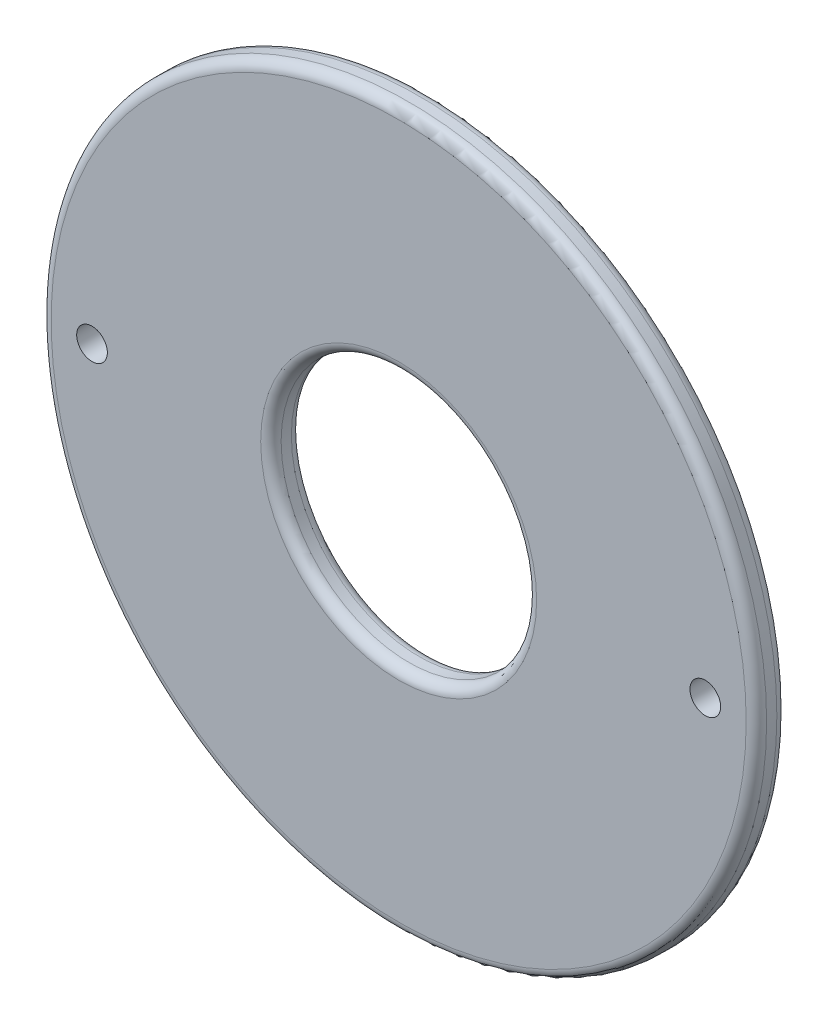
from build123d import *

# Parameters (mm, degrees)
CROQUIS1_R              = 35
CROQUIS1_R_2            = 12.5
CROQUIS1_R_3            = 1.5
SALIENTE_EXTRUIR1_DEPTH = 3
REDONDEO1_R             = 1


with BuildPart() as part:
    # Croquis1 → Saliente-Extruir1 (new body)
    with BuildSketch(Plane.XY):
        Circle(CROQUIS1_R)
        Circle(CROQUIS1_R_2, mode=Mode.SUBTRACT)
        with Locations((30, 0)):
            Circle(CROQUIS1_R_3, mode=Mode.SUBTRACT)
        with Locations((-30, 0)):
            Circle(CROQUIS1_R_3, mode=Mode.SUBTRACT)
    extrude(amount=SALIENTE_EXTRUIR1_DEPTH)

    # Redondeo1
    redondeo1_edges = [part.edges().sort_by_distance(p)[0] for p in [
        (-35, 0, 0),
        (-35, 0, 3),
        (-12.5, 0, 0),
        (-12.5, 0, 3),
    ]]
    fillet(redondeo1_edges, radius=REDONDEO1_R)


solid = part.part
